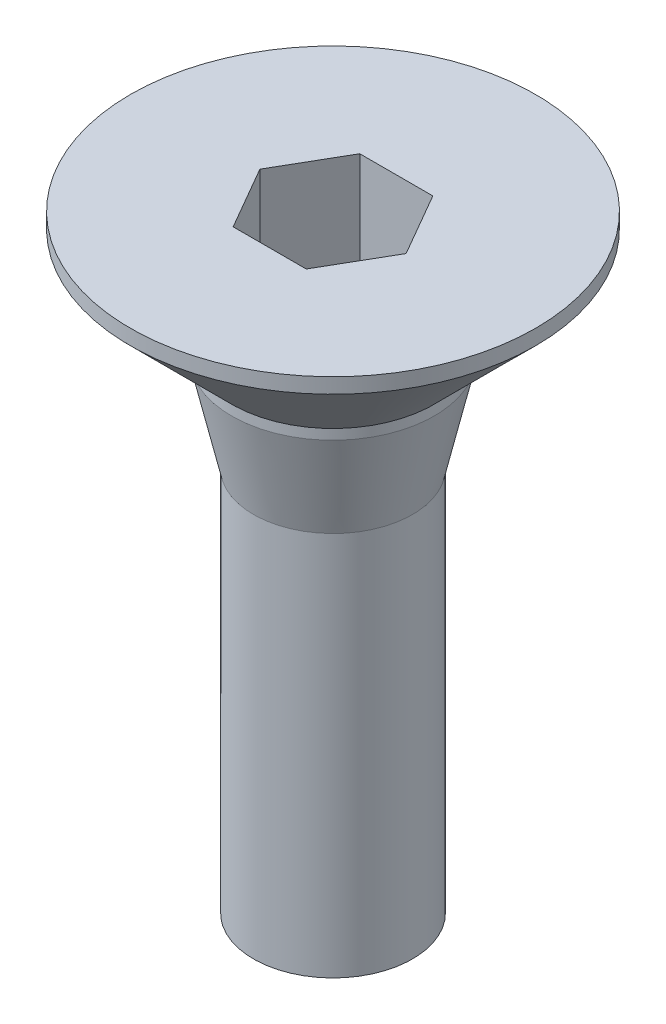
from build123d import *

# Parameters (mm, degrees)
SCHNITT_LINEAR_AUSTRAGEN1_DEPTH = 5.3


with BuildPart() as part:
    # Skizze1 → Basis-Rotation (revolve)
    with BuildSketch(Plane.XY, mode=Mode.PRIVATE) as basis_rotation_sk:
        Polygon((0, 0), (4, 0), (4, -0.3), (2, -2.3), (2, -2.5), (1.5705, -4.4), (1.5705, -12), (0, -12), align=None)
    revolve(basis_rotation_sk.sketch.rotate(Axis((0, 0, 0), (0, -1, 0)), 180), axis=Axis((0, 0, 0), (0, -1, 0)))

    # Skizze2 → Schnitt-Linear austragen1 (cut)
    with BuildSketch(Plane(origin=(0, 0, 0), x_dir=(-1, 0, 0), z_dir=(0, 1, 0))):
        Polygon((0.721687836, -1.25), (-0.721687836, -1.25), (-1.443375673, 0), (-0.721687836, 1.25), (0.721687836, 1.25), (1.443375673, 0), align=None)
    extrude(amount=-SCHNITT_LINEAR_AUSTRAGEN1_DEPTH, mode=Mode.SUBTRACT)


solid = part.part
